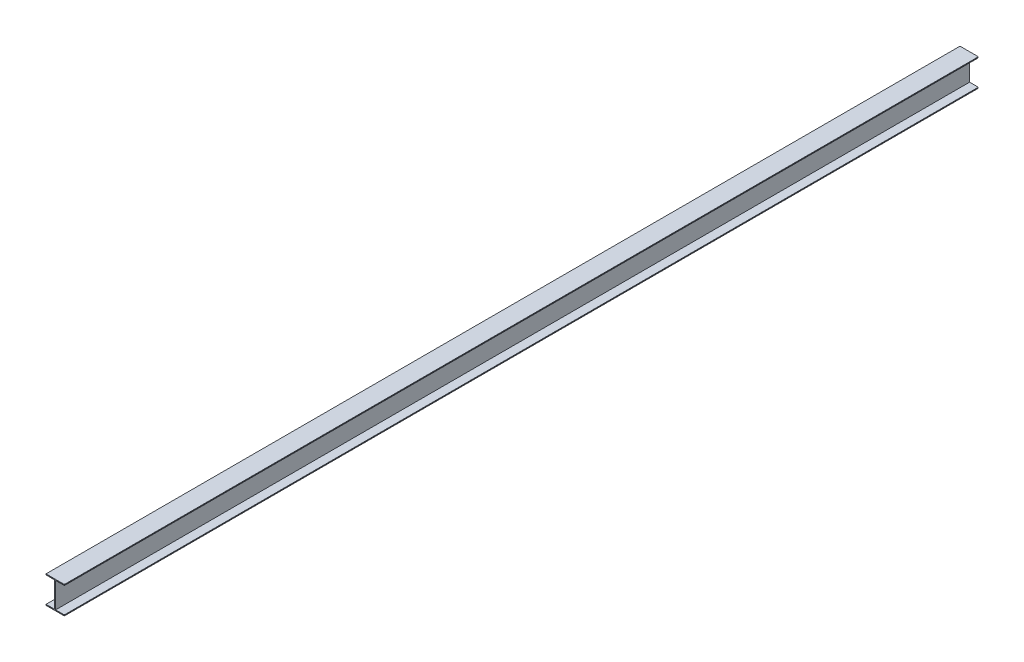
from build123d import *

# Parameters (mm, degrees)
BOSS_EXTRUDE1_DEPTH = 5062
FILLET1_R           = 3.175
FILLET2_R           = 3.175
FILLET3_R           = 3.175


with BuildPart() as part:
    # Sketch1 → Boss-Extrude1 (new body)
    with BuildSketch(Plane.XY):
        Polygon((0, -0.000240533), (101.6, -0.000240533), (101.6, -7.112240533), (53.408035714, -7.112240533), (53.408035714, -146.050240533), (101.6, -146.050240533), (101.6, -153.162240533), (0, -153.162240533), (0, -146.050240533), (47.566035714, -146.050240533), (47.566035714, -7.112240533), (0, -7.112240533), align=None)
    extrude(amount=BOSS_EXTRUDE1_DEPTH)

    # Fillet1
    fillet1_edges = [part.edges().sort_by_distance(p)[0] for p in [
        (101.6, -3.556240533, 0),
        (101.6, -149.606240533, 0),
        (101.6, -149.606240533, 5062),
        (101.6, -3.556240533, 5062),
    ]]
    fillet(fillet1_edges, radius=FILLET1_R)

    # Fillet2
    fillet2_edges = [part.edges().sort_by_distance(p)[0] for p in [
        (49.2125, -153.162240533, 0),
        (49.2125, -153.162240533, 5062),
        (0, -153.162240533, 2531),
        (101.6, -153.162240533, 2531),
        (101.6, -153.162240533, 2531),
        (101.6, -153.162240533, 2531),
        (0, -153.162240533, 2531),
        (0, -153.162240533, 2531),
        (101.6, -153.162240533, 2531),
        (100.67006403, -153.162240533, 5061.07006403),
        (100.67006403, -153.162240533, 0.92993597),
    ]]
    fillet(fillet2_edges, radius=FILLET2_R)

    # Fillet3
    fillet3_edges = [part.edges().sort_by_distance(p)[0] for p in [
        (75.916517857, -7.112240533, 0),
        (23.783017857, -7.112240533, 0),
        (0, -7.112240533, 2531),
        (75.916517857, -7.112240533, 5062),
        (101.6, -7.112240533, 2531),
        (100.67006403, -7.112240533, 0.92993597),
        (100.67006403, -7.112240533, 5061.07006403),
        (23.783017857, -7.112240533, 5062),
    ]]
    fillet(fillet3_edges, radius=FILLET3_R)


solid = part.part
